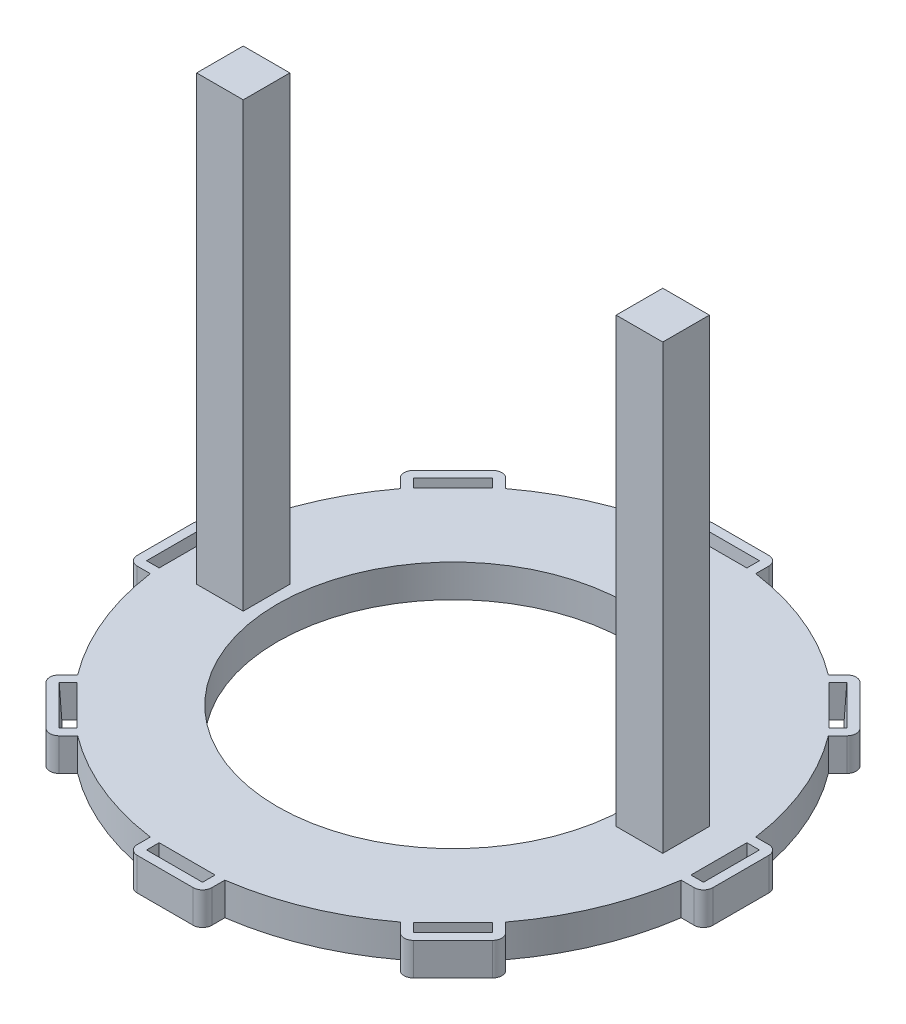
from build123d import *

# Parameters (mm, degrees)
BOSS_EXTRUDE1_DEPTH = 7
SKETCH2_W           = 10
SKETCH2_H           = 10
BOSS_EXTRUDE2_DEPTH = 95
SKETCH3_R           = 37.663730654
CUT_EXTRUDE1_DEPTH  = 130.030393965
CIRPATTERN1_COUNT   = 8


with BuildPart() as part:
    # Sketch1 → Boss-Extrude1 (new body)
    with BuildSketch(Plane(origin=(0, 0, 0), x_dir=(1, 0, 0), z_dir=(0, 1, 0))):
        with BuildLine():
            Line((-8, 56.940758688), (-8, 59.740758688))
            ThreePointArc((-8, 59.740758688), (-7.414213562, 61.154972251), (-6, 61.740758688))
            Line((-6, 61.740758688), (6, 61.740758688))
            ThreePointArc((6, 61.740758688), (7.414213562, 61.154972251), (8, 59.740758688))
            Line((8, 59.740758688), (8, 56.940758688))
            ThreePointArc((8, 56.940758688), (22.004297361, 53.123073119), (34.606342345, 45.920050844))
            Line((34.606342345, 45.920050844), (36.586241332, 47.899949831))
            ThreePointArc((36.586241332, 47.899949831), (38.000454895, 48.485736269), (39.414668457, 47.899949831))
            Line((39.414668457, 47.899949831), (47.899949831, 39.414668457))
            ThreePointArc((47.899949831, 39.414668457), (48.485736269, 38.000454895), (47.899949831, 36.586241332))
            Line((47.899949831, 36.586241332), (45.920050844, 34.606342345))
            ThreePointArc((45.920050844, 34.606342345), (53.123073119, 22.004297361), (56.940758688, 8))
            Line((56.940758688, 8), (59.740758688, 8))
            ThreePointArc((59.740758688, 8), (61.154972251, 7.414213562), (61.740758688, 6))
            Line((61.740758688, 6), (61.740758688, -6))
            ThreePointArc((61.740758688, -6), (61.154972251, -7.414213562), (59.740758688, -8))
            Line((59.740758688, -8), (56.940758688, -8))
            ThreePointArc((56.940758688, -8), (53.123073119, -22.004297361), (45.920050844, -34.606342345))
            Line((45.920050844, -34.606342345), (47.899949831, -36.586241332))
            ThreePointArc((47.899949831, -36.586241332), (48.485736269, -38.000454895), (47.899949831, -39.414668457))
            Line((47.899949831, -39.414668457), (39.414668457, -47.899949831))
            ThreePointArc((39.414668457, -47.899949831), (38.000454895, -48.485736269), (36.586241332, -47.899949831))
            Line((36.586241332, -47.899949831), (34.606342345, -45.920050844))
            ThreePointArc((34.606342345, -45.920050844), (22.004297361, -53.123073119), (8, -56.940758688))
            Line((8, -56.940758688), (8, -59.740758688))
            ThreePointArc((8, -59.740758688), (7.414213562, -61.154972251), (6, -61.740758688))
            Line((6, -61.740758688), (-6, -61.740758688))
            ThreePointArc((-6, -61.740758688), (-7.414213562, -61.154972251), (-8, -59.740758688))
            Line((-8, -59.740758688), (-8, -56.940758688))
            ThreePointArc((-8, -56.940758688), (-22.004297361, -53.123073119), (-34.606342345, -45.920050844))
            Line((-34.606342345, -45.920050844), (-36.586241332, -47.899949831))
            ThreePointArc((-36.586241332, -47.899949831), (-38.000454895, -48.485736269), (-39.414668457, -47.899949831))
            Line((-39.414668457, -47.899949831), (-47.899949831, -39.414668457))
            ThreePointArc((-47.899949831, -39.414668457), (-48.485736269, -38.000454895), (-47.899949831, -36.586241332))
            Line((-47.899949831, -36.586241332), (-45.920050844, -34.606342345))
            ThreePointArc((-45.920050844, -34.606342345), (-53.123073119, -22.004297361), (-56.940758688, -8))
            Line((-56.940758688, -8), (-59.740758688, -8))
            ThreePointArc((-59.740758688, -8), (-61.154972251, -7.414213562), (-61.740758688, -6))
            Line((-61.740758688, -6), (-61.740758688, 6))
            ThreePointArc((-61.740758688, 6), (-61.154972251, 7.414213562), (-59.740758688, 8))
            Line((-59.740758688, 8), (-56.940758688, 8))
            ThreePointArc((-56.940758688, 8), (-53.123073119, 22.004297361), (-45.920050844, 34.606342345))
            Line((-45.920050844, 34.606342345), (-47.899949831, 36.586241332))
            ThreePointArc((-47.899949831, 36.586241332), (-48.485736269, 38.000454895), (-47.899949831, 39.414668457))
            Line((-47.899949831, 39.414668457), (-39.414668457, 47.899949831))
            ThreePointArc((-39.414668457, 47.899949831), (-38.000454895, 48.485736269), (-36.586241332, 47.899949831))
            Line((-36.586241332, 47.899949831), (-34.606342345, 45.920050844))
            ThreePointArc((-34.606342345, 45.920050844), (-22.004297361, 53.123073119), (-8, 56.940758688))
        make_face()
    extrude(amount=BOSS_EXTRUDE1_DEPTH)

    # Sketch2 → Boss-Extrude2 (add)
    with BuildSketch(Plane(origin=(0, 7, 0), x_dir=(1, 0, 0), z_dir=(0, 1, 0))):
        with Locations((45, 0)):
            Rectangle(SKETCH2_W, SKETCH2_H)
        with Locations((-45, 0)):
            Rectangle(SKETCH2_W, SKETCH2_H)
    extrude(amount=BOSS_EXTRUDE2_DEPTH)

    # Sketch3 → Cut-Extrude1 (cut, through all)
    with BuildSketch(Plane(origin=(0, 7, 0), x_dir=(1, 0, 0), z_dir=(0, 1, 0))):
        with Locations(Location((0, 0, 0), (0, 0, 270))):
            Circle(SKETCH3_R)
    extrude(amount=-CUT_EXTRUDE1_DEPTH, mode=Mode.SUBTRACT)

    # Sketch7 → Cut-Loft1 section 0
    with BuildSketch(Plane.XZ):
        with BuildLine():
            Line((-6, -57.040758688), (6, -57.040758688))
            Line((6, -57.040758688), (6, -59.340758688))
            Line((6, -59.340758688), (-6, -59.340758688))
            Line((-6, -59.340758688), (-6, -57.040758688))
        make_face()
    # Sketch5 → Cut-Loft1 section 1
    with BuildSketch(Plane(origin=(0, 7, 0), x_dir=(1, 0, 0), z_dir=(0, 1, 0))):
        with BuildLine():
            Line((-6, 59.740758688), (6, 59.740758688))
            Line((6, 59.740758688), (6, 57.040758688))
            Line((6, 57.040758688), (-6, 57.040758688))
            Line((-6, 57.040758688), (-6, 59.740758688))
        make_face()
    cut_loft1 = loft(mode=Mode.SUBTRACT)

    # CirPattern1: Cut-Loft1 ×8 about axis
    cirpattern1_axis = Axis((0, 0, 0), (0, 1, 0))
    for i in range(1, CIRPATTERN1_COUNT):
        add(cut_loft1.rotate(cirpattern1_axis, i * 360 / CIRPATTERN1_COUNT), mode=Mode.SUBTRACT)


solid = part.part
